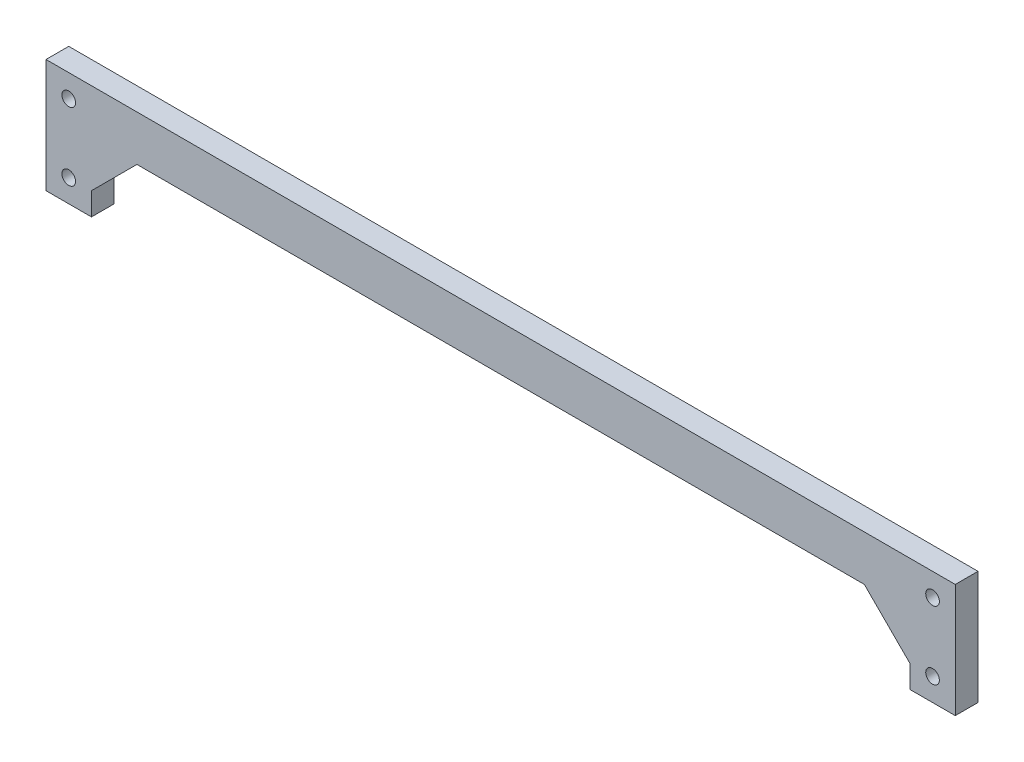
from build123d import *

# Parameters (mm, degrees)
SKETCH1_R           = 1.5
BOSS_EXTRUDE1_DEPTH = 5


with BuildPart() as part:
    # Sketch1 → Boss-Extrude1 (new body)
    with BuildSketch(Plane.XY):
        Polygon((0, 0), (0, -25), (10, -25), (10, -20), (20, -10), (100, -10), (100, 0), align=None)
        with Locations((5, -20)):
            Circle(SKETCH1_R, mode=Mode.SUBTRACT)
        with Locations((5, -5)):
            Circle(SKETCH1_R, mode=Mode.SUBTRACT)
    extrude(amount=BOSS_EXTRUDE1_DEPTH)

    # Mirror1: part across plane


with BuildPart() as part_1:
    add(part.part)
    add(part.part.mirror(Plane(origin=(100, -10, 5), x_dir=(0, 0, 1), z_dir=(-1, 0, 0))))


solid = part_1.part
